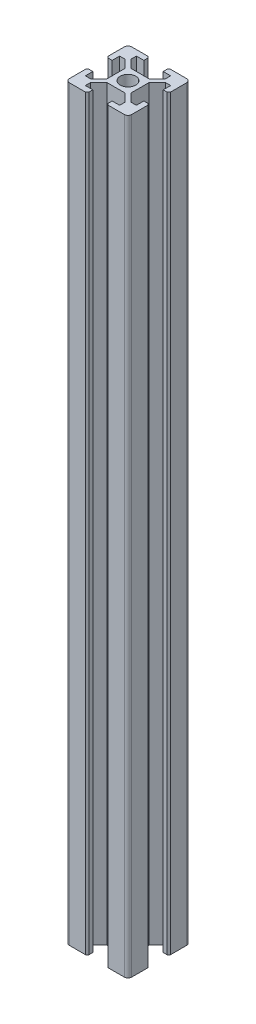
from build123d import *

# Parameters (mm, degrees)
SKETCH_1_R      = 2.5
EXTRUDE_1_DEPTH = 240


with BuildPart() as part:
    # 草图1 → 凸台-拉伸1 (new body)
    with BuildSketch(Plane(origin=(0, 0, 0), x_dir=(1, 0, 0), z_dir=(0, 1, 0))):
        with BuildLine():
            Line((5.5, 8.2), (3.1, 8.201478584))
            Line((3.1, 8.201478584), (3.1, 9.5))
            Line((3.1, 9.5), (3.6, 10))
            Line((3.6, 10), (8.8, 10))
            ThreePointArc((8.8, 10), (9.648528137, 9.648528137), (10, 8.8))
            Line((10, 8.8), (10, 3.6))
            Line((10, 3.6), (9.5, 3.1))
            Line((9.5, 3.1), (8.201478584, 3.1))
            Line((8.201478584, 3.1), (8.2, 5.5))
            Line((8.2, 5.5), (6.5, 5.5))
            Line((6.5, 5.5), (3.9, 2.9))
            Line((3.9, 2.9), (3.9, -2.9))
            Line((3.9, -2.9), (6.5, -5.5))
            Line((6.5, -5.5), (8.2, -5.5))
            Line((8.2, -5.5), (8.201478584, -3.1))
            Line((8.201478584, -3.1), (9.5, -3.1))
            Line((9.5, -3.1), (10, -3.6))
            Line((10, -3.6), (10, -8.8))
            ThreePointArc((10, -8.8), (9.648528137, -9.648528137), (8.8, -10))
            Line((8.8, -10), (3.6, -10))
            Line((3.6, -10), (3.1, -9.5))
            Line((3.1, -9.5), (3.1, -8.201478584))
            Line((3.1, -8.201478584), (5.5, -8.2))
            Line((5.5, -8.2), (5.5, -6.5))
            Line((5.5, -6.5), (2.9, -3.9))
            Line((2.9, -3.9), (-2.9, -3.9))
            Line((-2.9, -3.9), (-5.5, -6.5))
            Line((-5.5, -6.5), (-5.5, -8.2))
            Line((-5.5, -8.2), (-3.1, -8.201478584))
            Line((-3.1, -8.201478584), (-3.1, -9.5))
            Line((-3.1, -9.5), (-3.6, -10))
            Line((-3.6, -10), (-8.8, -10))
            ThreePointArc((-8.8, -10), (-9.648528137, -9.648528137), (-10, -8.8))
            Line((-10, -8.8), (-10, -3.6))
            Line((-10, -3.6), (-9.5, -3.1))
            Line((-9.5, -3.1), (-8.201478584, -3.1))
            Line((-8.201478584, -3.1), (-8.2, -5.5))
            Line((-8.2, -5.5), (-6.5, -5.5))
            Line((-6.5, -5.5), (-3.9, -2.9))
            Line((-3.9, -2.9), (-3.9, 2.9))
            Line((-3.9, 2.9), (-6.5, 5.5))
            Line((-6.5, 5.5), (-8.2, 5.5))
            Line((-8.2, 5.5), (-8.201478584, 3.1))
            Line((-8.201478584, 3.1), (-9.5, 3.1))
            Line((-9.5, 3.1), (-10, 3.6))
            Line((-10, 3.6), (-10, 8.8))
            ThreePointArc((-10, 8.8), (-9.648528137, 9.648528137), (-8.8, 10))
            Line((-8.8, 10), (-3.6, 10))
            Line((-3.6, 10), (-3.1, 9.5))
            Line((-3.1, 9.5), (-3.1, 8.201478584))
            Line((-3.1, 8.201478584), (-5.5, 8.2))
            Line((-5.5, 8.2), (-5.5, 6.5))
            Line((-5.5, 6.5), (-2.9, 3.9))
            Line((-2.9, 3.9), (2.9, 3.9))
            Line((2.9, 3.9), (5.5, 6.5))
            Line((5.5, 6.5), (5.5, 8.2))
        make_face()
        with Locations(Location((0, 0, 0), (0, 0, 270))):
            Circle(SKETCH_1_R, mode=Mode.SUBTRACT)
    extrude(amount=EXTRUDE_1_DEPTH)


solid = part.part
